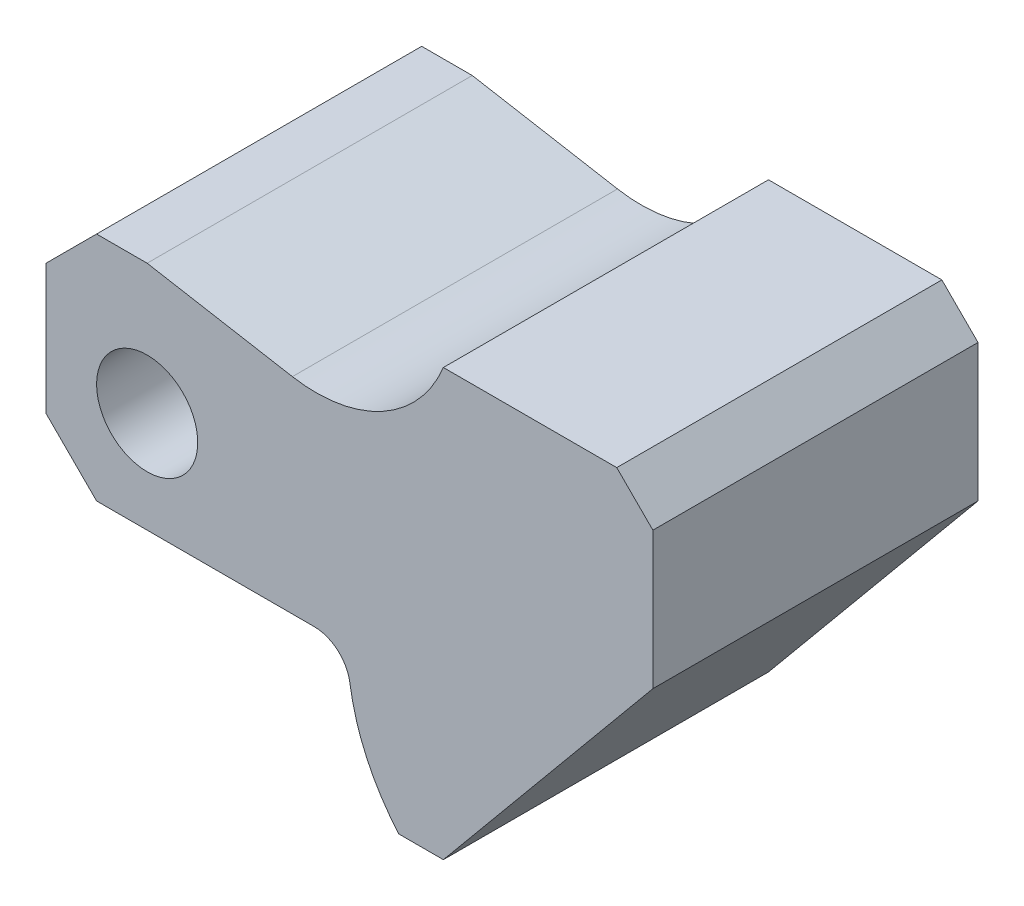
from build123d import *

# Parameters (mm, degrees)
ESQUISSE1_R        = 7
BOSS_EXTRU_1_DEPTH = 45
CHANFREIN1_SIZE    = 7
CHANFREIN2_SIZE    = 5


with BuildPart() as part:
    # Esquisse1 → Boss.-Extru.1 (new body)
    with BuildSketch(Plane.XY):
        with BuildLine():
            Line((-14, 18), (0, 18))
            Line((0, 18), (20.104042352, 14.455114912))
            ThreePointArc((20.104042352, 14.455114912), (32.591637328, 16.535902458), (41, 26))
            Line((41, 26), (65, 26))
            Line((65, 26), (70, 26))
            Line((70, 26), (70, 2))
            Line((70, 2), (41, -33))
            Line((41, -33), (34.833954843, -33))
            ThreePointArc((34.833954843, -33), (30.394982646, -26.115672061), (28.058152443, -18.264705882))
            ThreePointArc((28.058152443, -18.264705882), (26.377749482, -15.213413768), (23.112513701, -14))
            Line((23.112513701, -14), (-14, -14))
            Line((-14, -14), (-14, 18))
        make_face()
        with Locations(Location((0, 0, 0), (0, 0, 180))):
            Circle(ESQUISSE1_R, mode=Mode.SUBTRACT)
    extrude(amount=BOSS_EXTRU_1_DEPTH)

    # Chanfrein1
    chanfrein1_edges = [part.edges().sort_by_distance(p)[0] for p in [
        (-14, -14, 22.5),
        (-14, 18, 22.5),
    ]]
    chamfer(chanfrein1_edges, length=CHANFREIN1_SIZE)

    # Chanfrein2
    chanfrein2_edges = [part.edges().sort_by_distance(p)[0] for p in [
        (70, 26, 22.5),
    ]]
    chamfer(chanfrein2_edges, length=CHANFREIN2_SIZE)


solid = part.part
